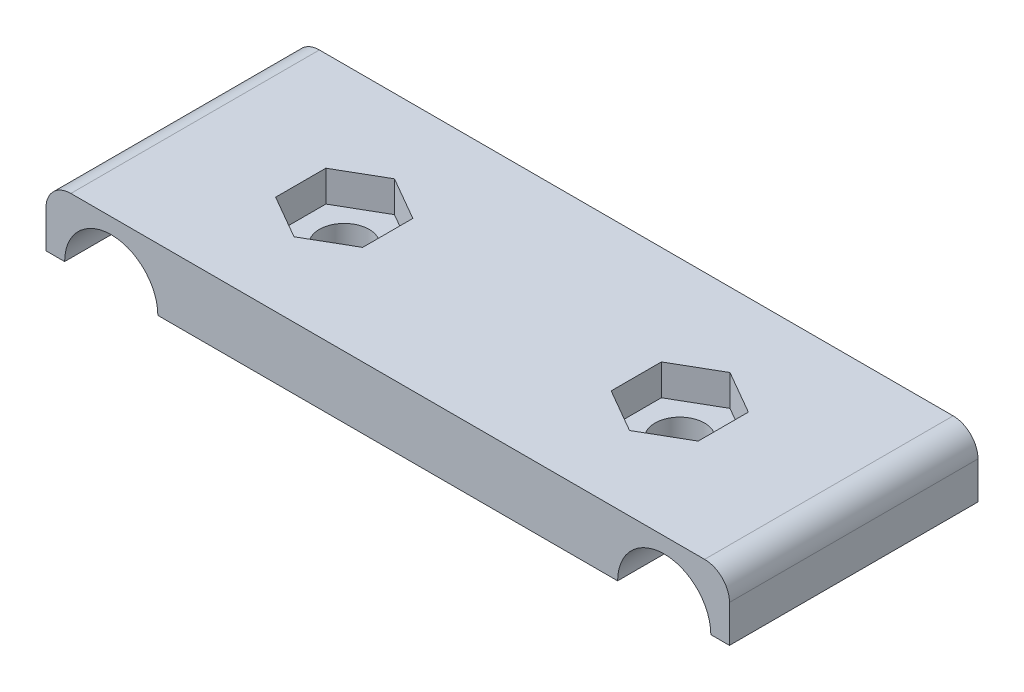
from build123d import *

# Parameters (mm, degrees)
EXTRUDE_1_DEPTH     = 20
FILLET_1_R          = 2
SKETCH_2_R          = 2
CUT_EXTRUDE_1_DEPTH = 35.369317712
CUT_EXTRUDE_2_DEPTH = 2.5


with BuildPart() as part:
    # 草圖1 → 填料-伸長1 (new body)
    with BuildSketch(Plane.XY):
        with BuildLine():
            Line((-18.5, -2.5), (18.5, -2.5))
            ThreePointArc((18.5, -2.5), (22.25, 1.25), (26, -2.5))
            Line((26, -2.5), (27.5, -2.5))
            Line((27.5, -2.5), (27.5, 2.5))
            Line((27.5, 2.5), (-27.5, 2.5))
            Line((-27.5, 2.5), (-27.5, -2.5))
            Line((-27.5, -2.5), (-26, -2.5))
            ThreePointArc((-26, -2.5), (-22.25, 1.25), (-18.5, -2.5))
        make_face()
    extrude(amount=EXTRUDE_1_DEPTH)

    # 圓角1
    fillet_1_edges = [part.edges().sort_by_distance(p)[0] for p in [
        (-27.5, 2.5, 10),
        (27.5, 2.5, 10),
    ]]
    fillet(fillet_1_edges, radius=FILLET_1_R)

    # 草圖2 → 除料-伸長1 (cut, through all)
    with BuildSketch(Plane(origin=(0, 2.5, 0), x_dir=(1, 0, 0), z_dir=(0, 1, 0))):
        with Locations(Location((13.5, -10, 0), (0, 0, 270))):
            Circle(SKETCH_2_R)
        with Locations(Location((-13.5, -10, 0), (0, 0, 270))):
            Circle(SKETCH_2_R)
    extrude(amount=-CUT_EXTRUDE_1_DEPTH, mode=Mode.SUBTRACT)

    # 草圖3 → 除料-伸長2 (cut)
    with BuildSketch(Plane(origin=(0, 2.5, 0), x_dir=(1, 0, 0), z_dir=(0, 1, 0))):
        Polygon((13.5, -5.958548116), (10, -7.979274058), (10, -12.020725942), (13.5, -14.041451884), (17, -12.020725942), (17, -7.979274058), align=None)
        Polygon((-13.5, -5.958548116), (-17, -7.979274058), (-17, -12.020725942), (-13.5, -14.041451884), (-10, -12.020725942), (-10, -7.979274058), align=None)
    extrude(amount=-CUT_EXTRUDE_2_DEPTH, mode=Mode.SUBTRACT)


solid = part.part
